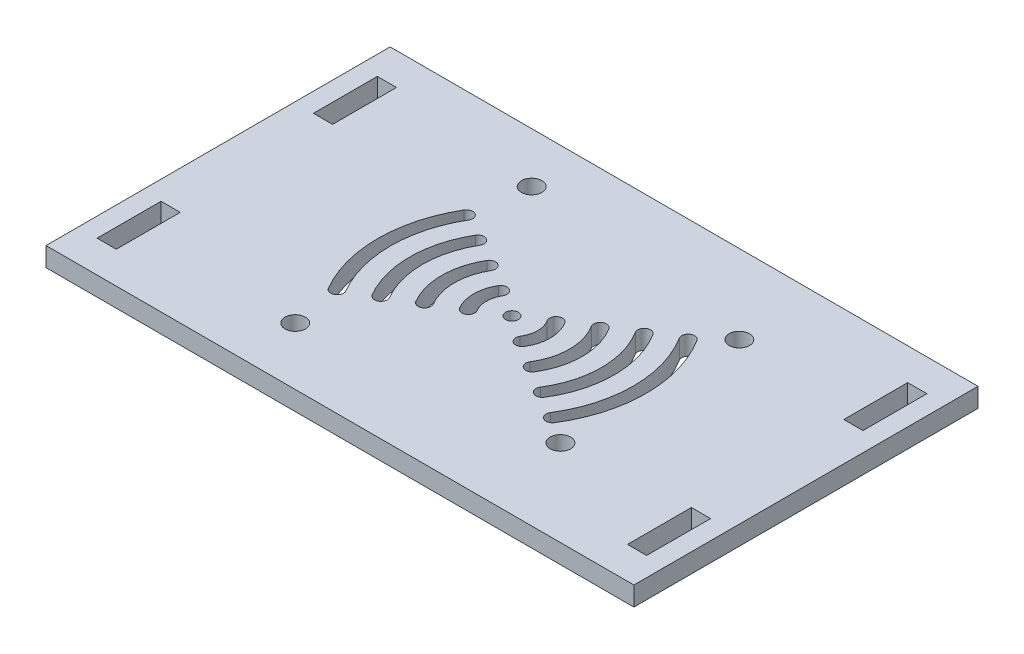
from build123d import *

# Parameters (mm, degrees)
SKETCH1_W           = 92
SKETCH1_H           = 53.85
SKETCH1_R           = 1
SKETCH1_R_2         = 1.6
SKETCH1_W_2         = 3
SKETCH1_H_2         = 10
BOSS_EXTRUDE1_DEPTH = 3


with BuildPart() as part:
    # Sketch1 → Boss-Extrude1 (new body)
    with BuildSketch(Plane(origin=(0, 0, 0), x_dir=(1, 0, 0), z_dir=(0, 1, 0))):
        with Locations((46, 26.925)):
            Rectangle(SKETCH1_W, SKETCH1_H)
        with Locations(Location((46, 26.925, 0), (0, 0, 270))):
            Circle(SKETCH1_R, mode=Mode.SUBTRACT)
        with Locations(Location((30, 46, 0), (0, 0, 270))):
            Circle(SKETCH1_R_2, mode=Mode.SUBTRACT)
        with Locations(Location((67, 41.5, 0), (0, 0, 270))):
            Circle(SKETCH1_R_2, mode=Mode.SUBTRACT)
        with Locations(Location((67, 13.5, 0), (0, 0, 270))):
            Circle(SKETCH1_R_2, mode=Mode.SUBTRACT)
        with Locations(Location((30, 9, 0), (0, 0, 270))):
            Circle(SKETCH1_R_2, mode=Mode.SUBTRACT)
        with Locations((4.5, 43.85)):
            Rectangle(SKETCH1_W_2, SKETCH1_H_2, mode=Mode.SUBTRACT)
        with Locations((4.5, 10)):
            Rectangle(SKETCH1_W_2, SKETCH1_H_2, mode=Mode.SUBTRACT)
        with Locations((87.5, 10)):
            Rectangle(SKETCH1_W_2, SKETCH1_H_2, mode=Mode.SUBTRACT)
        with Locations((87.5, 43.85)):
            Rectangle(SKETCH1_W_2, SKETCH1_H_2, mode=Mode.SUBTRACT)
        with BuildLine():
            ThreePointArc((40.82182341, 29.955921841), (40, 26.925), (40.82182341, 23.894078159))
            ThreePointArc((40.82182341, 23.894078159), (42.190006482, 23.536202368), (42.547882273, 24.904385439))
            ThreePointArc((42.547882273, 24.904385439), (42, 26.925), (42.547882273, 28.945614561))
            ThreePointArc((42.547882273, 28.945614561), (42.190006482, 30.313797632), (40.82182341, 29.955921841))
        make_face(mode=Mode.SUBTRACT)
        with BuildLine():
            ThreePointArc((36.506676252, 32.481690042), (35, 26.925), (36.506676252, 21.368309958))
            ThreePointArc((36.506676252, 21.368309958), (37.874859324, 21.010434167), (38.232735115, 22.378617239))
            ThreePointArc((38.232735115, 22.378617239), (37, 26.925), (38.232735115, 31.471382761))
            ThreePointArc((38.232735115, 31.471382761), (37.874859324, 32.839565833), (36.506676252, 32.481690042))
        make_face(mode=Mode.SUBTRACT)
        with BuildLine():
            ThreePointArc((32.191529094, 35.007458242), (30, 26.925), (32.191529094, 18.842541758))
            ThreePointArc((32.191529094, 18.842541758), (33.559712166, 18.484665966), (33.917587957, 19.852849038))
            ThreePointArc((33.917587957, 19.852849038), (32, 26.925), (33.917587957, 33.997150962))
            ThreePointArc((33.917587957, 33.997150962), (33.559712166, 35.365334034), (32.191529094, 35.007458242))
        make_face(mode=Mode.SUBTRACT)
        with BuildLine():
            ThreePointArc((27.876381936, 37.533226443), (25, 26.925), (27.876381936, 16.316773557))
            ThreePointArc((27.876381936, 16.316773557), (29.244565008, 15.958897766), (29.602440799, 17.327080837))
            ThreePointArc((29.602440799, 17.327080837), (27, 26.925), (29.602440799, 36.522919163))
            ThreePointArc((29.602440799, 36.522919163), (29.244565008, 37.891102234), (27.876381936, 37.533226443))
        make_face(mode=Mode.SUBTRACT)
        with BuildLine():
            ThreePointArc((51.08533044, 30.1092447), (52, 26.925), (51.08533044, 23.7407553))
            ThreePointArc((51.08533044, 23.7407553), (49.707067917, 23.423907676), (49.390220294, 24.8021702))
            ThreePointArc((49.390220294, 24.8021702), (50, 26.925), (49.390220294, 29.0478298))
            ThreePointArc((49.390220294, 29.0478298), (49.707067917, 30.426092324), (51.08533044, 30.1092447))
        make_face(mode=Mode.SUBTRACT)
        with BuildLine():
            ThreePointArc((55.323105808, 32.76278195), (57, 26.925), (55.323105808, 21.08721805))
            ThreePointArc((55.323105808, 21.08721805), (53.944843284, 20.770370426), (53.627995661, 22.14863295))
            ThreePointArc((53.627995661, 22.14863295), (55, 26.925), (53.627995661, 31.70136705))
            ThreePointArc((53.627995661, 31.70136705), (53.944843284, 33.079629574), (55.323105808, 32.76278195))
        make_face(mode=Mode.SUBTRACT)
        with BuildLine():
            ThreePointArc((59.560881175, 35.416319201), (62, 26.925), (59.560881175, 18.433680799))
            ThreePointArc((59.560881175, 18.433680799), (58.182618651, 18.116833176), (57.865771028, 19.495095699))
            ThreePointArc((57.865771028, 19.495095699), (60, 26.925), (57.865771028, 34.354904301))
            ThreePointArc((57.865771028, 34.354904301), (58.182618651, 35.733166824), (59.560881175, 35.416319201))
        make_face(mode=Mode.SUBTRACT)
        with BuildLine():
            ThreePointArc((63.798656542, 38.069856451), (67, 26.925), (63.798656542, 15.780143549))
            ThreePointArc((63.798656542, 15.780143549), (62.420394018, 15.463295926), (62.103546395, 16.841558449))
            ThreePointArc((62.103546395, 16.841558449), (65, 26.925), (62.103546395, 37.008441551))
            ThreePointArc((62.103546395, 37.008441551), (62.420394018, 38.386704074), (63.798656542, 38.069856451))
        make_face(mode=Mode.SUBTRACT)
    extrude(amount=BOSS_EXTRUDE1_DEPTH)


solid = part.part
